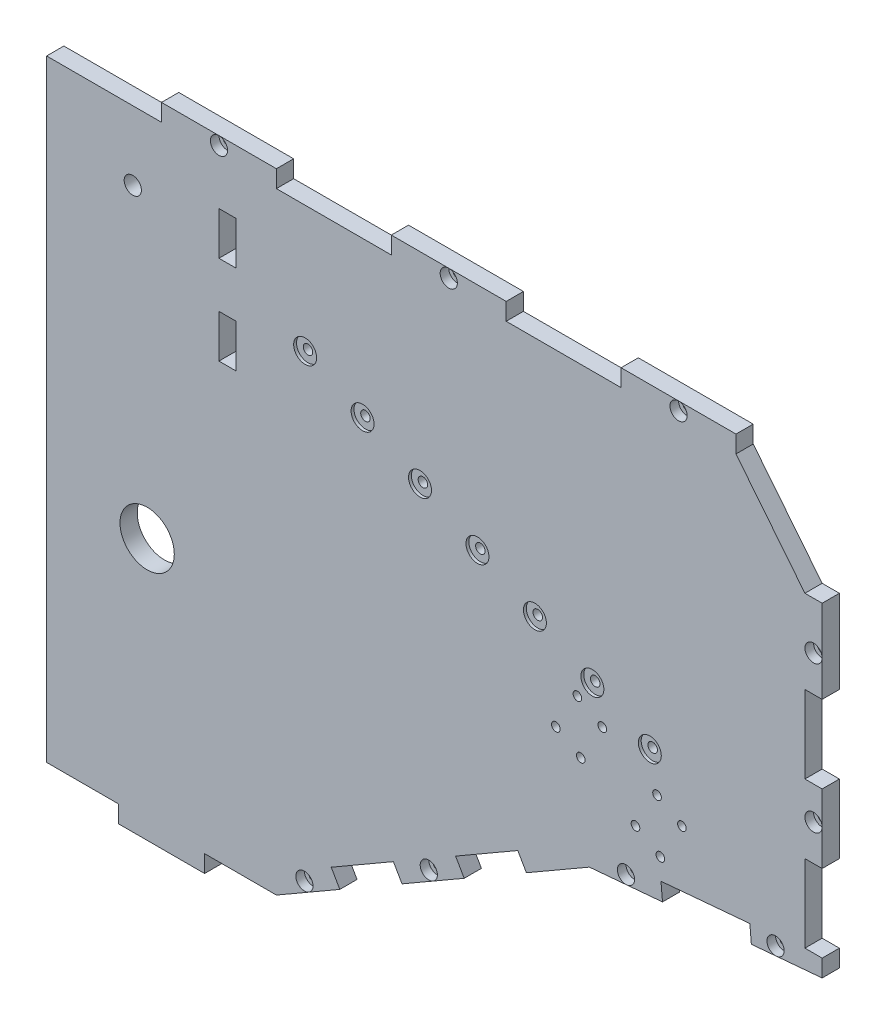
from build123d import *

# Parameters (mm, degrees)
ESQUISSE1_W                   = 270
ESQUISSE1_H                   = 213
BOSS_EXTRU_1_DEPTH            = 6
ESQUISSE3_R                   = 9.45
ESQUISSE3_R_2                 = 1.5
ENL_V_MAT_EXTRU_1_DEPTH       = 10
ESQUISSE4_R                   = 3
ENL_V_MAT_EXTRU_2_DEPTH       = 10
ENL_V_MAT_EXTRU_11_DEPTH      = 173.055950202
ENL_V_MAT_EXTRU_11_DEPTH_BACK = 173.055950202
ESQUISSE7_W                   = 6
ESQUISSE7_H                   = 30
ESQUISSE7_H_2                 = 27
ENL_V_MAT_EXTRU_13_DEPTH      = 10
ESQUISSE8_W                   = 40
ESQUISSE8_H                   = 6
BOSS_EXTRU_2_DEPTH            = 6
ENL_V_MAT_EXTRU_14_DEPTH      = 10
ENL_V_MAT_EXTRU_15_DEPTH      = 6
ESQUISSE11_W                  = 6
ESQUISSE11_H                  = 15
ENL_V_MAT_EXTRU_16_DEPTH      = 10
ESQUISSE12_R                  = 1.65
ENL_V_MAT_EXTRU_17_DEPTH      = 176.833017377
ESQUISSE14_W                  = 30
ESQUISSE14_H                  = 6
BOSS_EXTRU_3_DEPTH            = 6
ENL_V_MAT_EXTRU_18_DEPTH      = 176.833017377
ESQUISSE16_R                  = 4
ENL_V_MAT_EXTRU_19_DEPTH      = 1
ESQUISSE17_R                  = 2.995
ENL_V_MAT_EXTRU_20_DEPTH      = 3
ESQUISSE18_R                  = 1.5
ENL_V_MAT_EXTRU_21_DEPTH      = 13


with BuildPart() as part:
    # Esquisse1 → Boss.-Extru.1 (new body)
    with BuildSketch(Plane.XY):
        Rectangle(ESQUISSE1_W, ESQUISSE1_H)
    extrude(amount=BOSS_EXTRU_1_DEPTH)

    # Esquisse3 → Enlèv. mat.-Extru.1 (cut)
    with BuildSketch(Plane.XY.offset(6)):
        with Locations((-100, -21.5)):
            Circle(ESQUISSE3_R)
        with Locations((58.459193141, 0.881055644)):
            Circle(ESQUISSE3_R_2)
        with Locations((49.798939104, 5.881055644)):
            Circle(ESQUISSE3_R_2)
        with Locations((42.298939104, -7.109325413)):
            Circle(ESQUISSE3_R_2)
        with Locations((50.959193141, -12.109325413)):
            Circle(ESQUISSE3_R_2)
        with Locations((70.011752025, -23.109325413)):
            Circle(ESQUISSE3_R_2)
        with Locations((78.672006063, -28.109325413)):
            Circle(ESQUISSE3_R_2)
        with Locations((86.172006063, -15.118944356)):
            Circle(ESQUISSE3_R_2)
        with Locations((77.511752025, -10.118944356)):
            Circle(ESQUISSE3_R_2)
    extrude(amount=-ENL_V_MAT_EXTRU_1_DEPTH, mode=Mode.SUBTRACT)

    # Esquisse4 → Enlèv. mat.-Extru.2 (cut)
    with BuildSketch(Plane.XY.offset(6)):
        with Locations((-105, 82.5)):
            Circle(ESQUISSE4_R)
    extrude(amount=-ENL_V_MAT_EXTRU_2_DEPTH, mode=Mode.SUBTRACT)

    # Esquisse5 → Enlèv. mat.-Extru.11 (cut, two sides: drawn at the far end of the back side and taken through both)
    with BuildSketch(Plane.XY.offset(6).offset(-ENL_V_MAT_EXTRU_11_DEPTH_BACK)):
        Polygon((135, -36.5), (53.963742643, -43.589753853), (-55, -106.5), (135, -106.5), align=None)
    extrude(amount=ENL_V_MAT_EXTRU_11_DEPTH + ENL_V_MAT_EXTRU_11_DEPTH_BACK, mode=Mode.SUBTRACT)

    # Esquisse7 → Enlèv. mat.-Extru.13 (cut)
    with BuildSketch(Plane.XY.offset(6)):
        with Locations((132, 91.5)):
            Rectangle(ESQUISSE7_W, ESQUISSE7_H)
        with Locations((132, -17)):
            Rectangle(ESQUISSE7_W, ESQUISSE7_H_2)
        with Locations((132, 34)):
            Rectangle(ESQUISSE7_W, ESQUISSE7_H_2)
    extrude(amount=-ENL_V_MAT_EXTRU_13_DEPTH, mode=Mode.SUBTRACT)

    # Esquisse8 → Boss.-Extru.2 (add)
    with BuildSketch(Plane(origin=(0, 106.5, 0), x_dir=(1, 0, 0), z_dir=(0, 1, 0))):
        with Locations((85, -3)):
            Rectangle(ESQUISSE8_W, ESQUISSE8_H)
        with Locations((5, -3)):
            Rectangle(ESQUISSE8_W, ESQUISSE8_H)
        with Locations((-75, -3)):
            Rectangle(ESQUISSE8_W, ESQUISSE8_H)
    extrude(amount=BOSS_EXTRU_2_DEPTH)

    # Esquisse9 → Enlèv. mat.-Extru.14 (cut)
    with BuildSketch(Plane(origin=(0, 0, 0), x_dir=(-1, 0, 0), z_dir=(0, 0, -1))):
        Polygon((-110.35, -38.656595556), (-79.413742643, -41.363167367), (-78.890808186, -35.385999178), (-109.827065544, -32.679427367), align=None)
    extrude(amount=-ENL_V_MAT_EXTRU_14_DEPTH, mode=Mode.SUBTRACT)

    # Esquisse10 → Enlèv. mat.-Extru.15 (cut)
    with BuildSketch(Plane(origin=(0, 0, 0), x_dir=(-1, 0, 0), z_dir=(0, 0, -1))):
        Polygon((-32.03555308, -56.25), (-10.384917986, -68.75), (-7.384917986, -63.553847577), (-29.03555308, -51.053847577), align=None)
        Polygon((11.265717109, -81.25), (32.916352203, -93.75), (35.916352203, -88.553847577), (14.265717109, -76.053847577), align=None)
    extrude(amount=-ENL_V_MAT_EXTRU_15_DEPTH, mode=Mode.SUBTRACT)

    # Esquisse11 → Enlèv. mat.-Extru.16 (cut)
    with BuildSketch(Plane(origin=(0, 0, 0), x_dir=(-1, 0, 0), z_dir=(0, 0, -1))):
        with Locations((72, 52)):
            Rectangle(ESQUISSE11_W, ESQUISSE11_H)
        with Locations((72, 83)):
            Rectangle(ESQUISSE11_W, ESQUISSE11_H)
    extrude(amount=-ENL_V_MAT_EXTRU_16_DEPTH, mode=Mode.SUBTRACT)

    # Esquisse12 → Enlèv. mat.-Extru.17 (cut, through all)
    with BuildSketch(Plane.XY.offset(6)):
        with Locations((-25, 52.5)):
            Circle(ESQUISSE12_R)
        with Locations((35, 22.5)):
            Circle(ESQUISSE12_R)
        with Locations((-5, 42.5)):
            Circle(ESQUISSE12_R)
        with Locations((15, 32.5)):
            Circle(ESQUISSE12_R)
        with Locations((55, 12.5)):
            Circle(ESQUISSE12_R)
        with Locations((75, 2.5)):
            Circle(ESQUISSE12_R)
        with Locations((-45, 62.5)):
            Circle(ESQUISSE12_R)
    extrude(amount=-ENL_V_MAT_EXTRU_17_DEPTH, mode=Mode.SUBTRACT)

    # Esquisse14 → Boss.-Extru.3 (add)
    with BuildSketch(Plane.XZ.offset(106.5)):
        with Locations((-95, 3)):
            Rectangle(ESQUISSE14_W, ESQUISSE14_H)
    extrude(amount=BOSS_EXTRU_3_DEPTH)

    # Esquisse15 → Enlèv. mat.-Extru.18 (cut, through all)
    with BuildSketch(Plane.XY.offset(6)):
        Polygon((105, 106.5), (129, 106.5), (129, 76.5), align=None)
    extrude(amount=-ENL_V_MAT_EXTRU_18_DEPTH, mode=Mode.SUBTRACT)

    # Esquisse16 → Enlèv. mat.-Extru.19 (cut)
    with BuildSketch(Plane.XY.offset(6)):
        with Locations((-45, 62.5)):
            Circle(ESQUISSE16_R)
        with Locations((-25, 52.5)):
            Circle(ESQUISSE16_R)
        with Locations((-5, 42.5)):
            Circle(ESQUISSE16_R)
        with Locations((15, 32.5)):
            Circle(ESQUISSE16_R)
        with Locations((35, 22.5)):
            Circle(ESQUISSE16_R)
        with Locations((55, 12.5)):
            Circle(ESQUISSE16_R)
        with Locations((75, 2.5)):
            Circle(ESQUISSE16_R)
    extrude(amount=-ENL_V_MAT_EXTRU_19_DEPTH, mode=Mode.SUBTRACT)

    # Esquisse17 → Enlèv. mat.-Extru.20 (cut)
    with BuildSketch(Plane.XY.offset(6)):
        with Locations((-75, 109.5)):
            Circle(ESQUISSE17_R)
        with Locations((5, 109.5)):
            Circle(ESQUISSE17_R)
        with Locations((85, 109.5)):
            Circle(ESQUISSE17_R)
        with Locations((132, 60)):
            Circle(ESQUISSE17_R)
        with Locations((132, 9)):
            Circle(ESQUISSE17_R)
        with Locations((-1.940399562, -72.401923789)):
            Circle(ESQUISSE17_R)
        with Locations((118.78170639, -34.90745732)):
            Circle(ESQUISSE17_R)
        with Locations((66.699841688, -39.464030057)):
            Circle(ESQUISSE17_R)
        with Locations((-45.241669751, -97.401923789)):
            Circle(ESQUISSE17_R)
    extrude(amount=-ENL_V_MAT_EXTRU_20_DEPTH, mode=Mode.SUBTRACT)

    # Esquisse18 → Enlèv. mat.-Extru.21 (cut)
    with BuildSketch(Plane.XY.offset(6)):
        with Locations((-75, 109.5)):
            Circle(ESQUISSE18_R)
        with Locations((5, 109.5)):
            Circle(ESQUISSE18_R)
        with Locations((85, 109.5)):
            Circle(ESQUISSE18_R)
        with Locations((132, 60)):
            Circle(ESQUISSE18_R)
        with Locations((132, 9)):
            Circle(ESQUISSE18_R)
        with Locations((118.78170639, -34.90745732)):
            Circle(ESQUISSE18_R)
        with Locations((66.699841688, -39.464030057)):
            Circle(ESQUISSE18_R)
        with Locations((-1.940399562, -72.401923789)):
            Circle(ESQUISSE18_R)
        with Locations((-45.241669751, -97.401923789)):
            Circle(ESQUISSE18_R)
    extrude(amount=-ENL_V_MAT_EXTRU_21_DEPTH, mode=Mode.SUBTRACT)


solid = part.part
